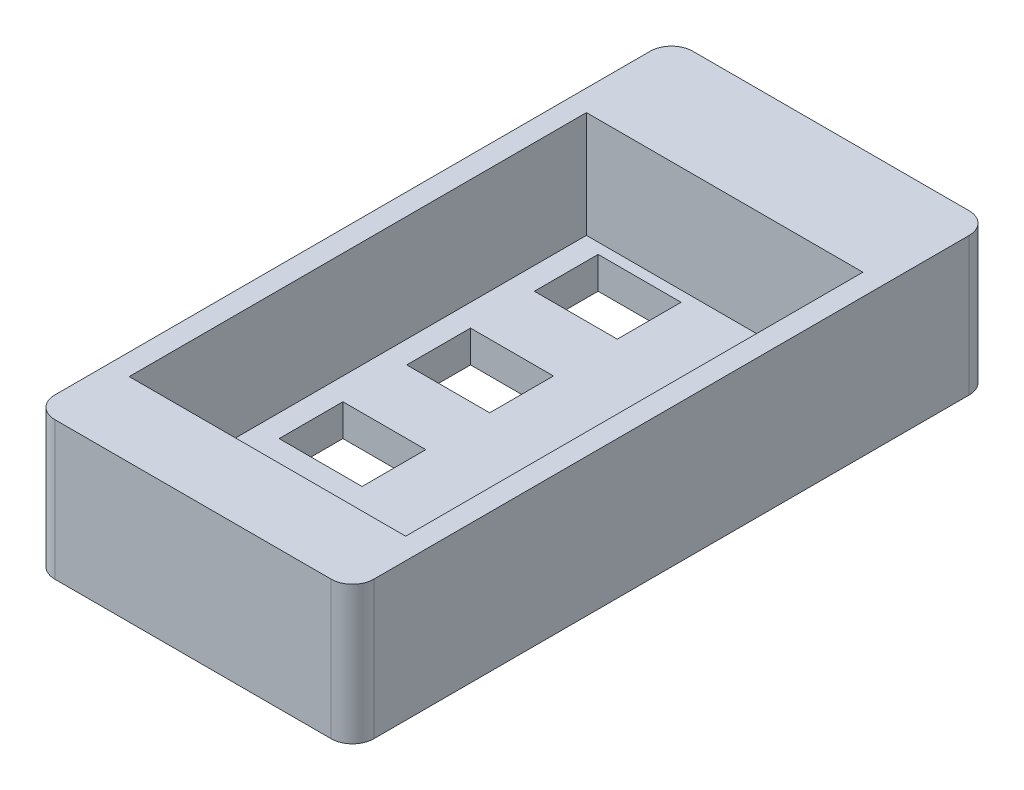
from build123d import *

# Parameters (mm, degrees)
SKETCH1_W           = 30
SKETCH1_H           = 60
BOSS_EXTRUDE1_DEPTH = 3
SKETCH2_W           = 12.8
SKETCH2_H           = 6
SKETCH2_W_2         = 7.8
CUT_EXTRUDE1_DEPTH  = 3
SKETCH4_W           = 30
SKETCH4_H           = 60
SKETCH4_W_2         = 26
SKETCH4_H_2         = 56
BOSS_EXTRUDE2_DEPTH = 10
SKETCH5_W           = 26
SKETCH5_H           = 8
SKETCH5_H_2         = 5
BOSS_EXTRUDE3_DEPTH = 10
FILLET1_R           = 2


with BuildPart() as part:
    # Sketch1 → Boss-Extrude1 (new body)
    with BuildSketch(Plane(origin=(0, 0, 0), x_dir=(1, 0, 0), z_dir=(0, 1, 0))):
        Rectangle(SKETCH1_W, SKETCH1_H)
    extrude(amount=BOSS_EXTRUDE1_DEPTH)

    # Sketch2 → Cut-Extrude1 (cut)
    with BuildSketch(Plane(origin=(0, 3, 0), x_dir=(1, 0, 0), z_dir=(0, 1, 0))):
        with Locations((0, -19)):
            Rectangle(SKETCH2_W, SKETCH2_H)
        with Locations((-7, 4)):
            Rectangle(SKETCH2_W_2, SKETCH2_H)
        with Locations((-7, -8)):
            Rectangle(SKETCH2_W_2, SKETCH2_H)
        with Locations((-7, 16)):
            Rectangle(SKETCH2_W_2, SKETCH2_H)
        with Locations((7, -8)):
            Rectangle(SKETCH2_W_2, SKETCH2_H)
        with Locations((7, 4)):
            Rectangle(SKETCH2_W_2, SKETCH2_H)
        with Locations((7, 16)):
            Rectangle(SKETCH2_W_2, SKETCH2_H)
    extrude(amount=-CUT_EXTRUDE1_DEPTH, mode=Mode.SUBTRACT)

    # Sketch4 → Boss-Extrude2 (add)
    with BuildSketch(Plane(origin=(0, 3, 0), x_dir=(1, 0, 0), z_dir=(0, 1, 0))):
        Rectangle(SKETCH4_W, SKETCH4_H)
        Rectangle(SKETCH4_W_2, SKETCH4_H_2, mode=Mode.SUBTRACT)
    extrude(amount=BOSS_EXTRUDE2_DEPTH)

    # Sketch5 → Boss-Extrude3 (add)
    with BuildSketch(Plane(origin=(0, 3, 0), x_dir=(1, 0, 0), z_dir=(0, 1, 0))):
        with Locations((0, 24)):
            Rectangle(SKETCH5_W, SKETCH5_H)
        with Locations((0, -25.5)):
            Rectangle(SKETCH5_W, SKETCH5_H_2)
    extrude(amount=BOSS_EXTRUDE3_DEPTH)

    # Fillet1
    fillet1_edges = [part.edges().sort_by_distance(p)[0] for p in [
        (15, 6.5, 30),
        (-15, 6.5, 30),
        (-15, 6.5, -30),
        (15, 6.5, -30),
    ]]
    fillet(fillet1_edges, radius=FILLET1_R)


solid = part.part
